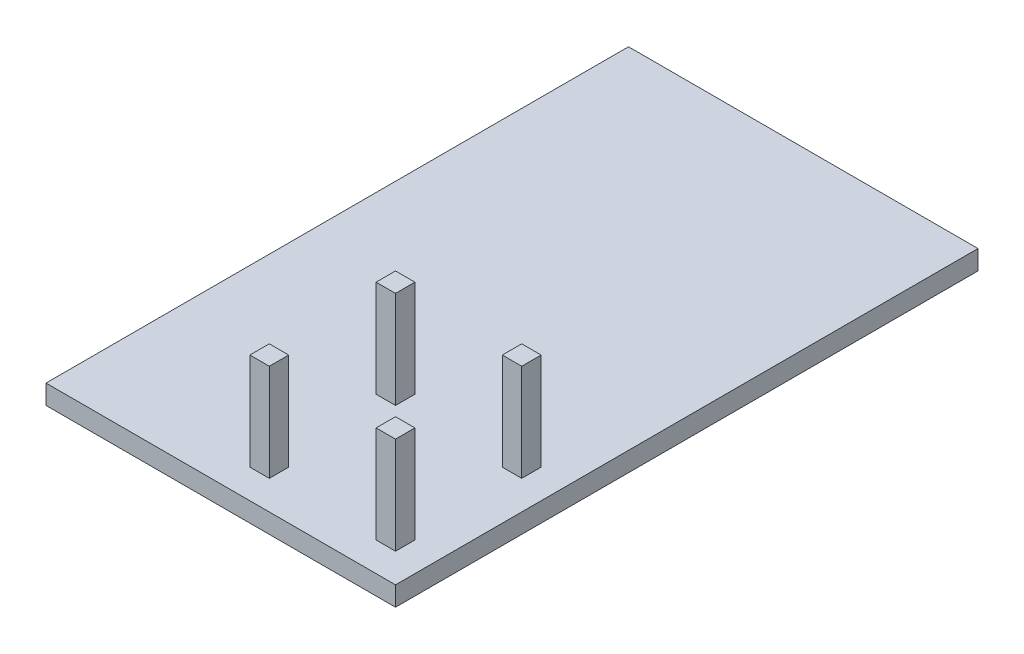
from build123d import *

# Parameters (mm, degrees)
SKETCH3_W           = 180
SKETCH3_H           = 300
BOSS_EXTRUDE1_DEPTH = 10
SKETCH4_W           = 10
SKETCH4_H           = 10
BOSS_EXTRUDE2_DEPTH = 50


with BuildPart() as part:
    # Sketch3 → Boss-Extrude1 (new body)
    with BuildSketch(Plane(origin=(0, 0, 0), x_dir=(1, 0, 0), z_dir=(0, 1, 0))):
        Rectangle(SKETCH3_W, SKETCH3_H)
    extrude(amount=BOSS_EXTRUDE1_DEPTH)

    # Sketch4 → Boss-Extrude2 (add)
    with BuildSketch(Plane(origin=(0, 10, 0), x_dir=(1, 0, 0), z_dir=(0, 1, 0))):
        with Locations((70, -130)):
            Rectangle(SKETCH4_W, SKETCH4_H)
        with Locations((70, -65)):
            Rectangle(SKETCH4_W, SKETCH4_H)
        with Locations((5, -130)):
            Rectangle(SKETCH4_W, SKETCH4_H)
        with Locations((5, -65)):
            Rectangle(SKETCH4_W, SKETCH4_H)
    extrude(amount=BOSS_EXTRUDE2_DEPTH)


solid = part.part
